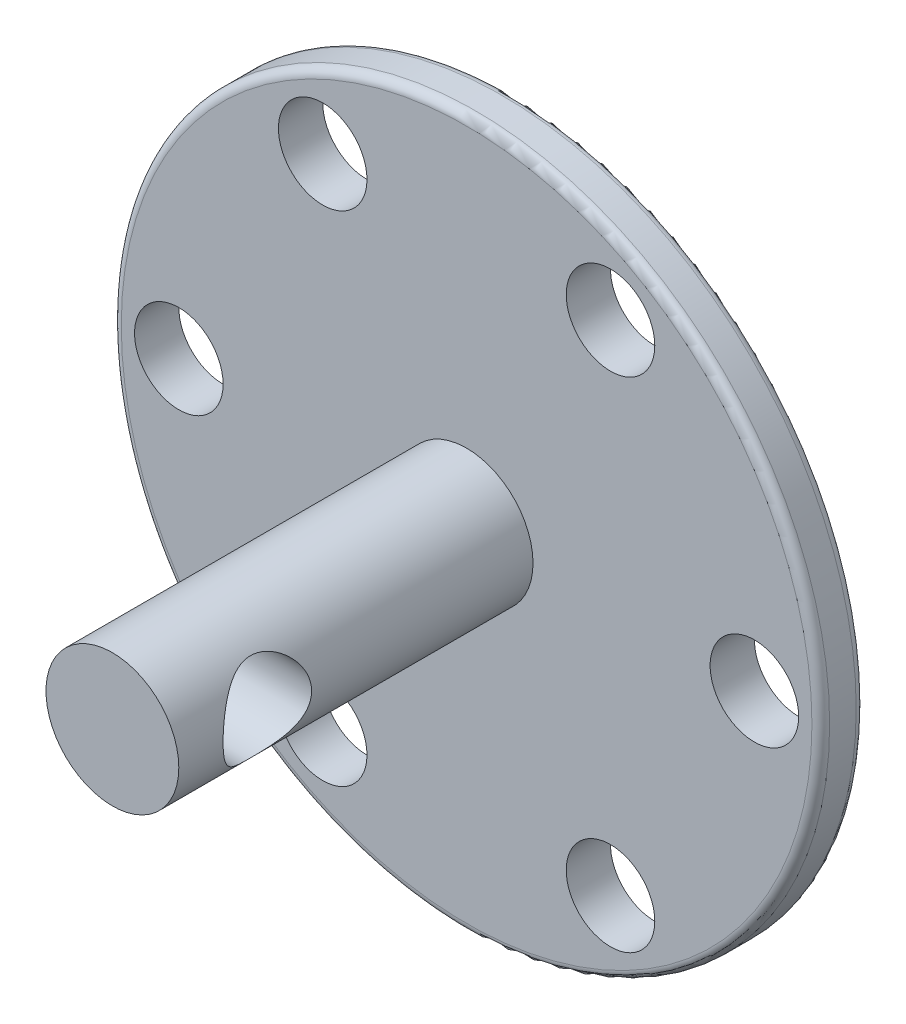
from build123d import *

# Parameters (mm, degrees)
SKETCH_1_R          = 80
SKETCH_1_R_2        = 10
EXTRUDE_1_DEPTH     = 10
SKETCH_3_R          = 15
EXTRUDE_4_DEPTH     = 90
SKETCH_4_R          = 10
CUT_EXTRUDE_3_DEPTH = 45
FILLET_1_R          = 2


with BuildPart() as part:
    # 草图1 → 凸台-拉伸1 (new body)
    with BuildSketch(Plane.XY):
        Circle(SKETCH_1_R)
        with Locations((-65, 0)):
            Circle(SKETCH_1_R_2, mode=Mode.SUBTRACT)
        with Locations((-32.5, 56.291651246)):
            Circle(SKETCH_1_R_2, mode=Mode.SUBTRACT)
        with Locations((32.5, 56.291651246)):
            Circle(SKETCH_1_R_2, mode=Mode.SUBTRACT)
        with Locations((65, 0)):
            Circle(SKETCH_1_R_2, mode=Mode.SUBTRACT)
        with Locations((32.5, -56.291651246)):
            Circle(SKETCH_1_R_2, mode=Mode.SUBTRACT)
        with Locations((-32.5, -56.291651246)):
            Circle(SKETCH_1_R_2, mode=Mode.SUBTRACT)
    extrude(amount=EXTRUDE_1_DEPTH)

    # 草图3 → 凸台-拉伸4 (add)
    with BuildSketch(Plane.XY):
        with Locations(Location((0, 0, 0), (0, 0, 180))):
            Circle(SKETCH_3_R)
    extrude(amount=EXTRUDE_4_DEPTH)

    # 草图4 → 切除-拉伸3 (cut, symmetric)
    with BuildSketch(Plane(origin=(0, 0, 0), x_dir=(0, 0, -1), z_dir=(1, 0, 0))):
        with Locations(Location((-70, 0, 0), (0, 0, 180))):
            Circle(SKETCH_4_R)
    extrude(amount=CUT_EXTRUDE_3_DEPTH, both=True, mode=Mode.SUBTRACT)

    # 圆角1
    fillet_1_edges = [part.edges().sort_by_distance(p)[0] for p in [
        (-80, 0, 0),
        (-80, 0, 10),
    ]]
    fillet(fillet_1_edges, radius=FILLET_1_R)


solid = part.part
